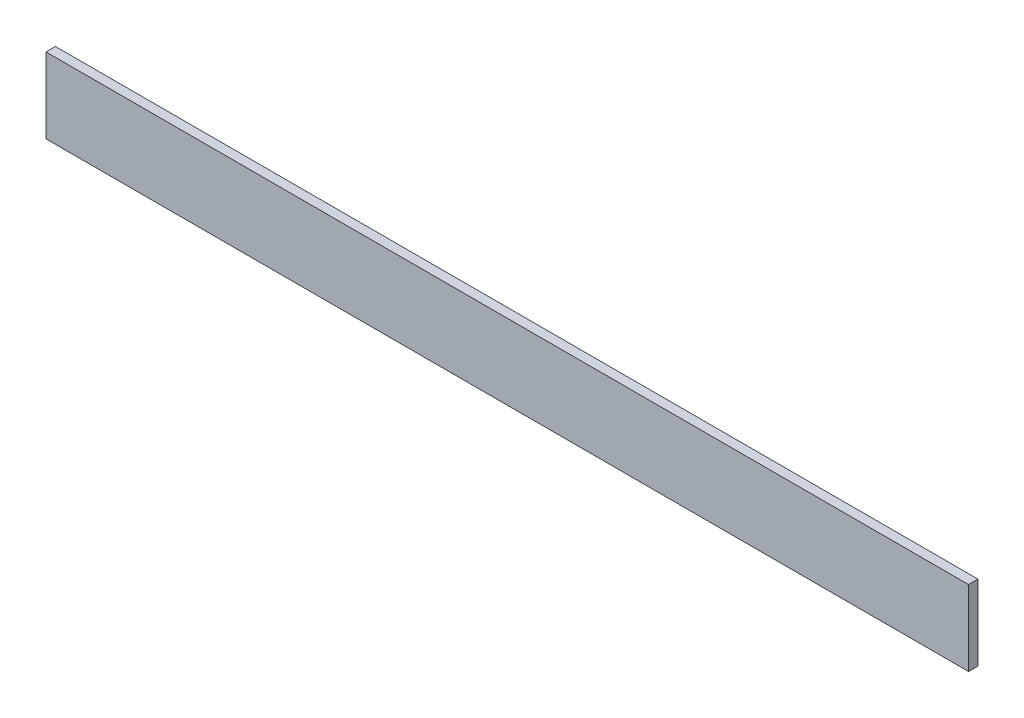
from build123d import *

# Parameters (mm, degrees)
SKETCH1_W           = 1866.9
SKETCH1_H           = 152.4
BOSS_EXTRUDE1_DEPTH = 19.05


with BuildPart() as part:
    # Sketch1 → Boss-Extrude1 (new body)
    with BuildSketch(Plane.XY):
        Rectangle(SKETCH1_W, SKETCH1_H)
    extrude(amount=BOSS_EXTRUDE1_DEPTH)


solid = part.part
